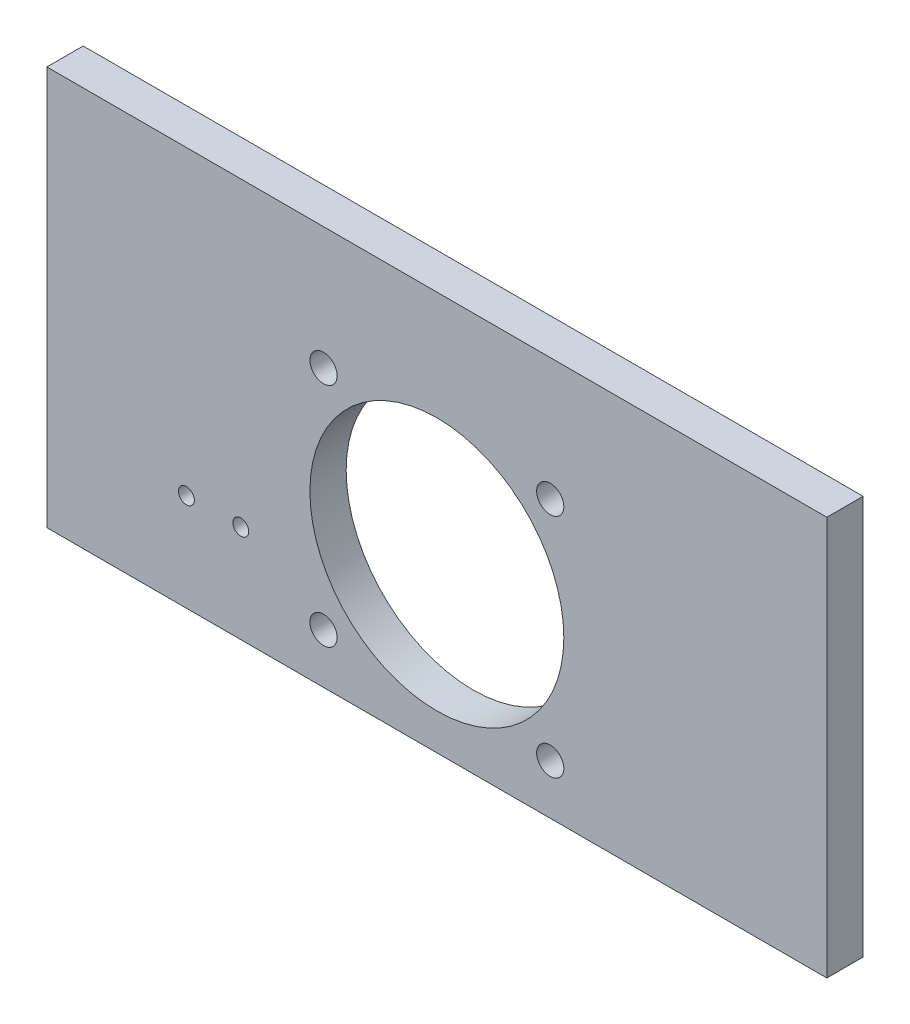
from build123d import *

# Parameters (mm, degrees)
SKETCH1_W             = 86
SKETCH1_H             = 44
BOSS_EXTRUDE1_DEPTH   = 4
SKETCH2_R             = 14
CUT_EXTRUDE1_DEPTH    = 4
SKETCH3_R             = 1.5
CUT_EXTRUDE3_DEPTH    = 4
F_1_0MM_DOWEL_HOLE1_D = 1.75


with BuildPart() as part:
    # Sketch1 → Boss-Extrude1 (new body)
    with BuildSketch(Plane.XY):
        with Locations((43, 22)):
            Rectangle(SKETCH1_W, SKETCH1_H)
    extrude(amount=BOSS_EXTRUDE1_DEPTH)

    # Sketch2 → Cut-Extrude1 (cut)
    with BuildSketch(Plane.XY.offset(4)):
        with Locations((43, 18)):
            Circle(SKETCH2_R)
    extrude(amount=-CUT_EXTRUDE1_DEPTH, mode=Mode.SUBTRACT)

    # Sketch3 → Cut-Extrude3 (cut)
    with BuildSketch(Plane.XY.offset(4)):
        with Locations((30.5, 30.5)):
            Circle(SKETCH3_R)
        with Locations((55.5, 30.5)):
            Circle(SKETCH3_R)
        with Locations((55.5, 5.5)):
            Circle(SKETCH3_R)
        with Locations((30.5, 5.5)):
            Circle(SKETCH3_R)
    extrude(amount=-CUT_EXTRUDE3_DEPTH, mode=Mode.SUBTRACT)

    # Ø1.0mm Dowel Hole1 (through all)
    with Locations(Plane.XY.offset(4)):
        with Locations((15.38, 10.75), (21.38, 10.75)):
            Hole(F_1_0MM_DOWEL_HOLE1_D / 2)


solid = part.part
